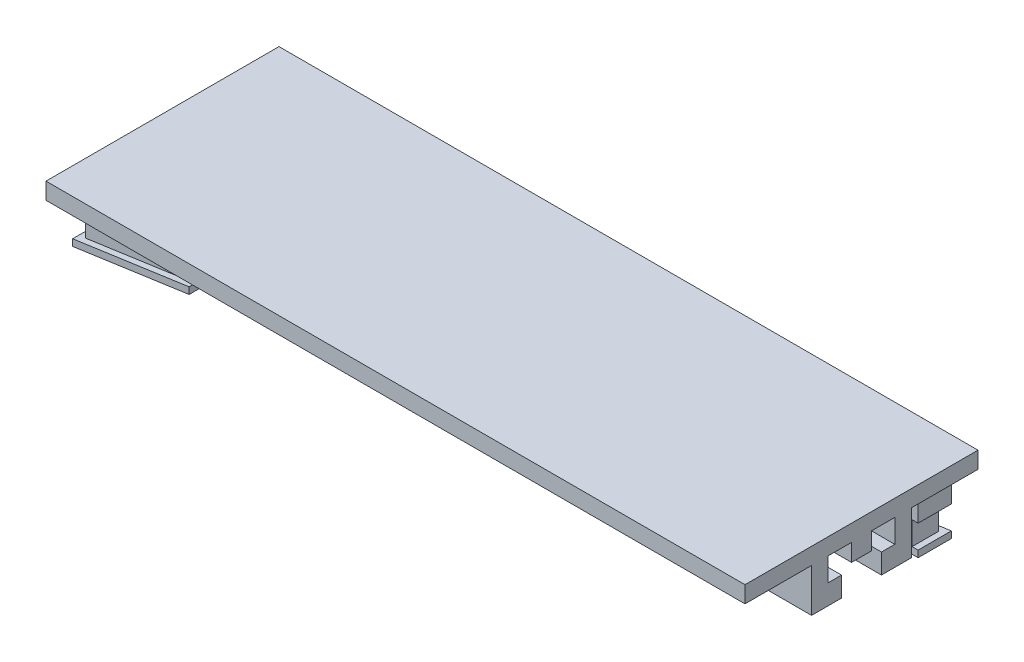
from build123d import *

# Parameters (mm, degrees)
BOSS_EXTRUDE1_DEPTH = 210
BOSS_EXTRUDE2_DEPTH = 15
SKETCH3_W           = 10
SKETCH3_H           = 7
CUT_EXTRUDE1_DEPTH  = 1.8
SKETCH5_W           = 10
SKETCH5_H           = 7
CUT_EXTRUDE2_DEPTH  = 1.8
CUT_EXTRUDE3_DEPTH  = 7
CUT_EXTRUDE4_DEPTH  = 7


with BuildPart() as part:
    # Sketch1 → Boss-Extrude1 (new body)
    with BuildSketch(Plane(origin=(0, 0, 0), x_dir=(0, 0, -1), z_dir=(1, 0, 0))):
        Polygon((-35, -2.5), (-15, -2.5), (-15, -15.5), (-6, -15.5), (-6, -9.5), (-10, -9.5), (-10, -2.5), (-3, -2.5), (-3, -7.710081811), (3, -7.710081811), (3, -2.5), (10, -2.5), (10, -9.5), (6, -9.5), (6, -15.5), (15, -15.5), (15, -2.5), (35, -2.5), (35, 2.5), (-35, 2.5), align=None)
    extrude(amount=BOSS_EXTRUDE1_DEPTH)

    # Sketch2 → Boss-Extrude2 (add)
    with BuildSketch(Plane.XZ.offset(2.5)):
        Polygon((1, 28), (31, 23), (31, 18), (1, 18), align=None)
        Polygon((209, -18), (209, -28), (179, -23), (179, -18), align=None)
    extrude(amount=BOSS_EXTRUDE2_DEPTH)

    # Sketch3 → Cut-Extrude1 (cut)
    with BuildSketch(Plane.ZY.offset(-1)):
        with Locations((23, -12)):
            Rectangle(SKETCH3_W, SKETCH3_H)
    extrude(amount=-CUT_EXTRUDE1_DEPTH, mode=Mode.SUBTRACT)

    # Sketch5 → Cut-Extrude2 (cut)
    with BuildSketch(Plane(origin=(209, 0, 0), x_dir=(0, 0, -1), z_dir=(1, 0, 0))):
        with Locations((23, -12)):
            Rectangle(SKETCH5_W, SKETCH5_H)
    extrude(amount=-CUT_EXTRUDE2_DEPTH, mode=Mode.SUBTRACT)

    # Sketch7 → Cut-Extrude3 (cut)
    with BuildSketch(Plane.XZ.offset(8.5)):
        Polygon((207.2, -27.7), (179, -23), (179, -21.2), (207.2, -25.9), align=None)
    extrude(amount=CUT_EXTRUDE3_DEPTH, mode=Mode.SUBTRACT)

    # Sketch8 → Cut-Extrude4 (cut)
    with BuildSketch(Plane.XZ.offset(8.5)):
        Polygon((2.8, 27.7), (31, 23), (31, 21.2), (2.8, 25.9), align=None)
    extrude(amount=CUT_EXTRUDE4_DEPTH, mode=Mode.SUBTRACT)


solid = part.part
